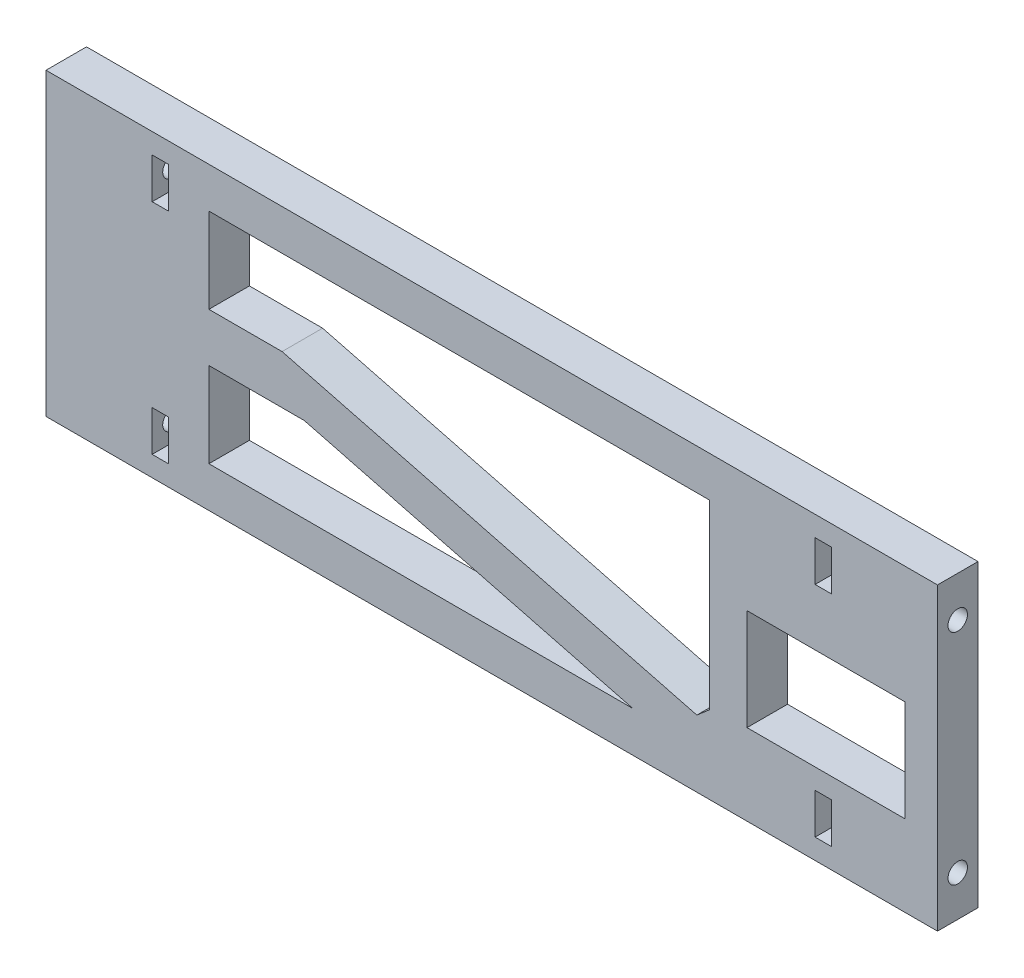
from build123d import *

# Parameters (mm, degrees)
SKETCH1_W                     = 110
SKETCH1_H                     = 37
BOSS_EXTRUDE1_DEPTH           = 5
M2_CLEARANCE_HOLE1_AT_2_COUNT = 2
M2_CLEARANCE_HOLE1_AT_2_PITCH = 27
SKETCH5_W                     = 2
SKETCH5_H                     = 5
CUT_EXTRUDE1_DEPTH            = 4
SKETCH6_W                     = 19.5
SKETCH6_H                     = 12.5
CUT_EXTRUDE2_DEPTH            = 10
CUT_EXTRUDE3_DEPTH            = 59.243025334


with BuildPart() as part:
    # Sketch1 → Boss-Extrude1 (new body)
    with BuildSketch(Plane.XY):
        Rectangle(SKETCH1_W, SKETCH1_H)
    extrude(amount=BOSS_EXTRUDE1_DEPTH)

    # Sketch4 → M2 Clearance Hole1 (revolve, cut)
    with BuildSketch(Plane(origin=(-55, 13.5, 2.5), x_dir=(0, 0, 1), z_dir=(0, 1, 0))):
        Polygon((0, 0), (0, 14.721032743), (1.2, 14), (1.2, 0), align=None)
    m2_clearance_hole1 = revolve(axis=Axis((-61.35, 13.5, 2.5), (1, 0, 0)), mode=Mode.SUBTRACT)

    # M2 Clearance Hole1 at 2: M2 Clearance Hole1 ×2
    with Locations(*[(0, -i * M2_CLEARANCE_HOLE1_AT_2_PITCH, 0) for i in range(1, M2_CLEARANCE_HOLE1_AT_2_COUNT)]):
        add(m2_clearance_hole1, mode=Mode.SUBTRACT)

    # Sketch5 → Cut-Extrude1 (cut)
    with BuildSketch(Plane.XY.offset(5)):
        with Locations((-40.9, 13.5)):
            Rectangle(SKETCH5_W, SKETCH5_H)
        with Locations((-40.9, -13.5)):
            Rectangle(SKETCH5_W, SKETCH5_H)
    cut_extrude1 = extrude(amount=-CUT_EXTRUDE1_DEPTH, mode=Mode.SUBTRACT)

    # Mirror1: M2 Clearance Hole1, Cut-Extrude1 across plane
    add(m2_clearance_hole1.mirror(Plane(origin=(0, 0, 0), x_dir=(0, 0, 1), z_dir=(1, 0, 0))), mode=Mode.SUBTRACT)
    add(cut_extrude1.mirror(Plane(origin=(0, 0, 0), x_dir=(0, 0, 1), z_dir=(1, 0, 0))), mode=Mode.SUBTRACT)

    # Mirror1 copy 1 sketch → Mirror1 copy 1 (revolve, cut)
    with BuildSketch(Plane(origin=(55, -13.5, 2.5), x_dir=(0, 0, 1), z_dir=(0, 1, 0))):
        Polygon((0, 0), (0, -14.721032743), (1.2, -14), (1.2, 0), align=None)
    revolve(axis=Axis((61.35, -13.5, 2.5), (1, 0, 0)), mode=Mode.SUBTRACT)

    # Sketch6 → Cut-Extrude2 (cut)
    with BuildSketch(Plane.XY.offset(5)):
        with Locations((41.25, -2.25)):
            Rectangle(SKETCH6_W, SKETCH6_H)
    extrude(amount=-CUT_EXTRUDE2_DEPTH, mode=Mode.SUBTRACT)

    # Sketch7 → Cut-Extrude3 (cut, through all)
    with BuildSketch(Plane.XY.offset(5)):
        Polygon((-34.9, -3), (-34.9, -13.5), (17.424359974, -13.5), (-23.127364164, -3), align=None)
        Polygon((-34.9, 13.5), (-34.9, 3), (-25.872635836, 3), (25.310097731, -10.252672084), (26.9, -8.878654338), (26.9, 13.5), align=None)
    extrude(amount=-CUT_EXTRUDE3_DEPTH, mode=Mode.SUBTRACT)


solid = part.part
